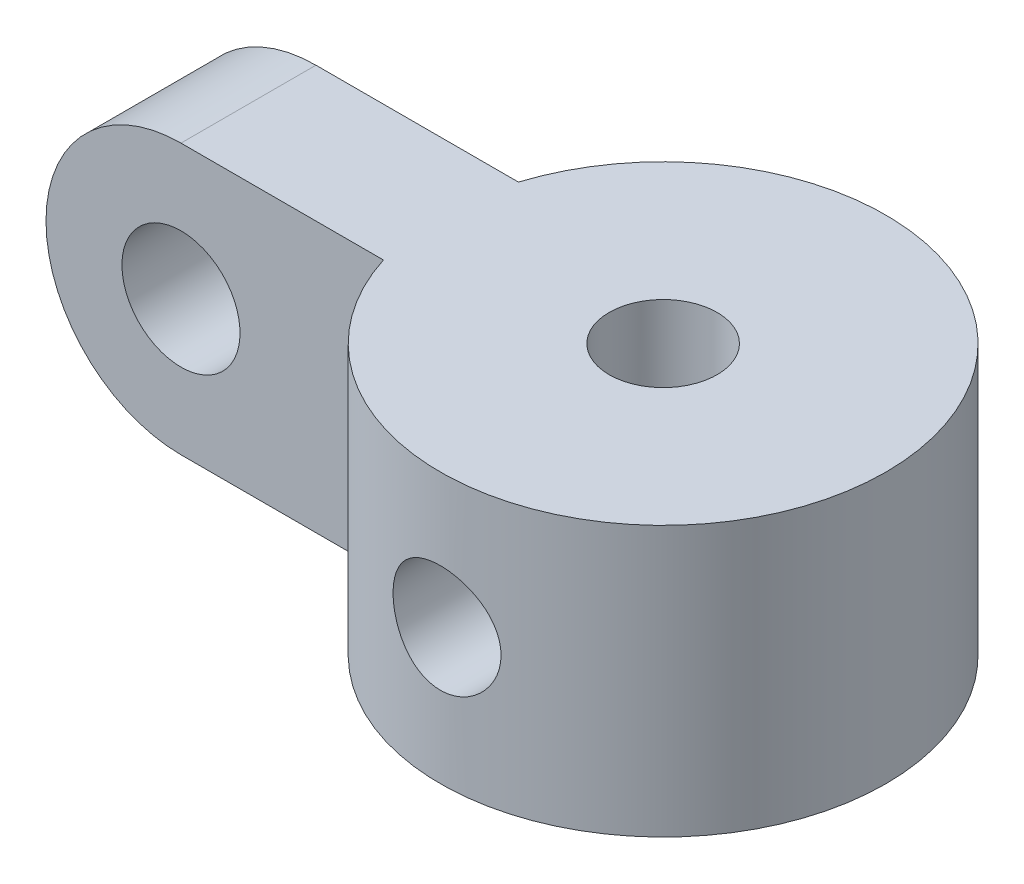
from build123d import *

# Parameters (mm, degrees)
SKETCH1_R               = 1.6
BOSS_EXTRUDE1_DEPTH     = 8
CUT_EXTRUDE1_DEPTH      = 21.082666196
CUT_EXTRUDE1_DEPTH_BACK = 21.082666196
SKETCH2_R               = 1.75
SKETCH2_R_2             = 1.6


with BuildPart() as part:
    # Sketch1 → Boss-Extrude1 (new body)
    with BuildSketch(Plane(origin=(0, 0, 0), x_dir=(1, 0, 0), z_dir=(0, 1, 0))):
        with BuildLine():
            Line((-6.289674077, 2), (-16.289674077, 2))
            Line((-16.289674077, 2), (-16.289674077, -2))
            Line((-16.289674077, -2), (-6.289674077, -2))
            ThreePointArc((-6.289674077, -2), (0, -6.6), (6.289674077, -2))
            ThreePointArc((6.289674077, -2), (6.6, 0), (6.289674077, 2))
            ThreePointArc((6.289674077, 2), (0, 6.6), (-6.289674077, 2))
        make_face()
        Circle(SKETCH1_R, mode=Mode.SUBTRACT)
    extrude(amount=BOSS_EXTRUDE1_DEPTH)

    # Sketch2 → Cut-Extrude1 (cut, two sides: drawn at the far end of the back side and taken through both)
    with BuildSketch(Plane.XY.offset(2).offset(-CUT_EXTRUDE1_DEPTH_BACK)):
        with BuildLine():
            Line((-16.289674077, 4), (-16.289674077, 0))
            Line((-16.289674077, 0), (-12.289674077, 0))
            ThreePointArc((-12.289674077, 0), (-15.118101202, 1.171572875), (-16.289674077, 4))
        make_face()
        with BuildLine():
            Line((-16.289674077, 8), (-16.289674077, 4))
            ThreePointArc((-16.289674077, 4), (-15.118101202, 6.828427125), (-12.289674077, 8))
            Line((-12.289674077, 8), (-16.289674077, 8))
        make_face()
        with Locations((-12.289674077, 4)):
            Circle(SKETCH2_R)
        with Locations((0, 4)):
            Circle(SKETCH2_R_2)
    extrude(amount=CUT_EXTRUDE1_DEPTH + CUT_EXTRUDE1_DEPTH_BACK, mode=Mode.SUBTRACT)


solid = part.part
